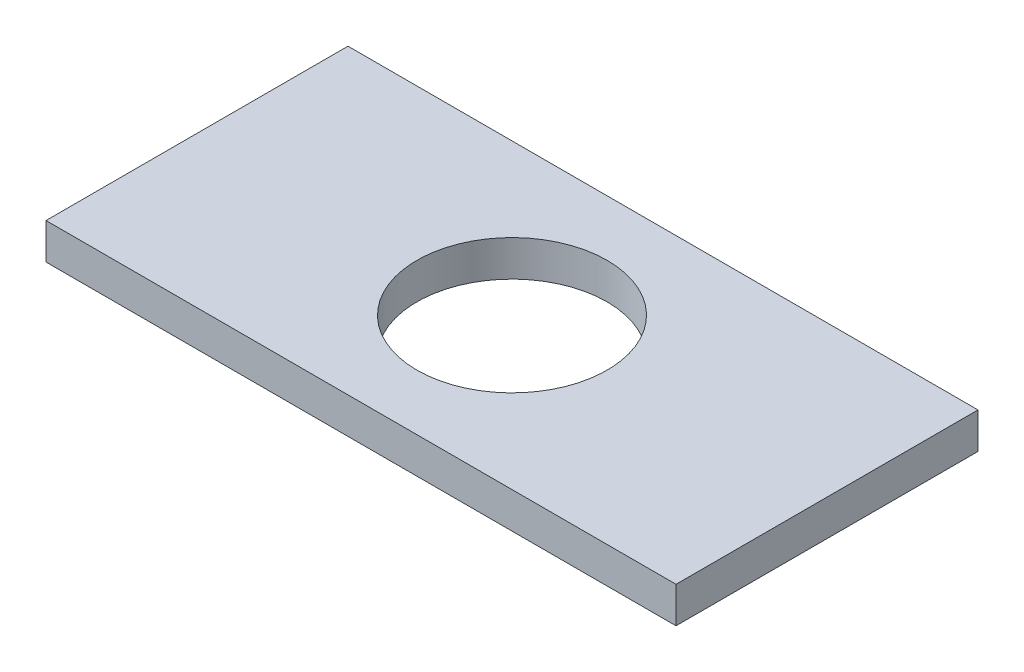
from build123d import *

# Parameters (mm, degrees)
SKETCH2_W           = 175.079769656
SKETCH2_H           = 83.917544766
SKETCH2_R           = 26.434113908
BOSS_EXTRUDE1_DEPTH = 10


with BuildPart() as part:
    # Sketch2 → Boss-Extrude1 (new body)
    with BuildSketch(Plane(origin=(0, 0, 0), x_dir=(1, 0, 0), z_dir=(0, 1, 0))):
        Rectangle(SKETCH2_W, SKETCH2_H)
        with Locations(Location((0, 0, 0), (0, 0, 270))):
            Circle(SKETCH2_R, mode=Mode.SUBTRACT)
    extrude(amount=BOSS_EXTRUDE1_DEPTH)


solid = part.part
